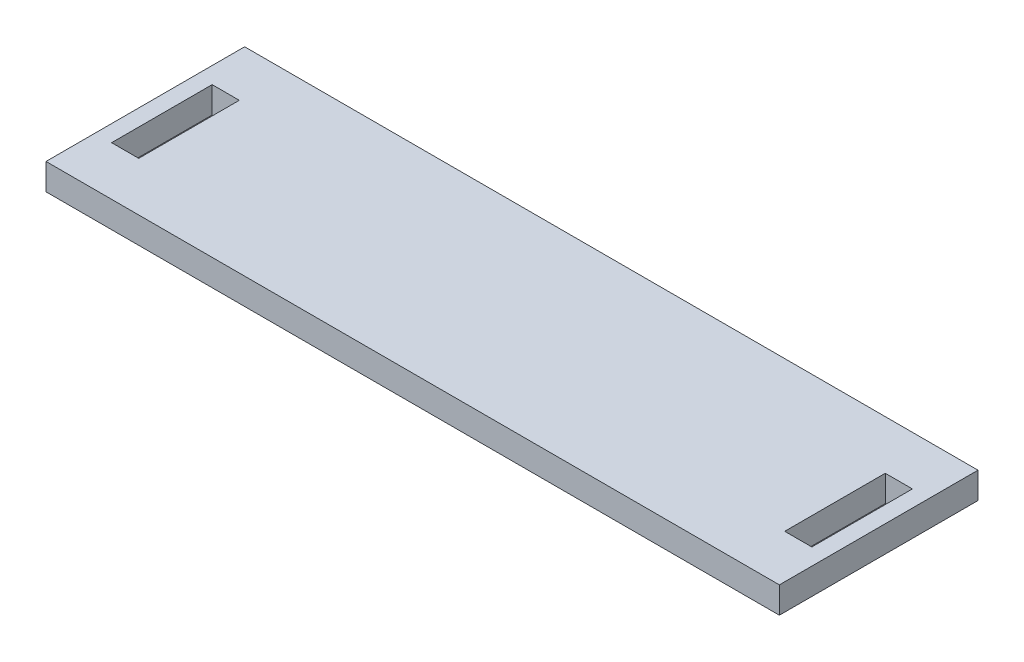
from build123d import *

# Parameters (mm, degrees)
SKETCH1_W           = 84.61
SKETCH1_H           = 24
BOSS_EXTRUDE1_DEPTH = 3.18
SKETCH10_W          = 24
SKETCH10_H          = 3.18
BOSS_EXTRUDE2_DEPTH = 2
SKETCH9_W           = 3.28
SKETCH9_H           = 12.15
CUT_EXTRUDE1_DEPTH  = 61.496753834


with BuildPart() as part:
    # Sketch1 → Boss-Extrude1 (new body)
    with BuildSketch(Plane(origin=(0, 0, 0), x_dir=(1, 0, 0), z_dir=(0, 1, 0))):
        with Locations((-13.483376754, -5.613867735)):
            Rectangle(SKETCH1_W, SKETCH1_H)
    extrude(amount=BOSS_EXTRUDE1_DEPTH)

    # Sketch10 → Boss-Extrude2 (add)
    with BuildSketch(Plane.ZY.offset(55.788376754)):
        with Locations((5.613867735, 1.59)):
            Rectangle(SKETCH10_W, SKETCH10_H)
    boss_extrude2 = extrude(amount=BOSS_EXTRUDE2_DEPTH)

    # Sketch9 → Cut-Extrude1 (cut, through all)
    with BuildSketch(Plane(origin=(0, 3.18, 0), x_dir=(1, 0, 0), z_dir=(0, 1, 0))):
        with Locations((-54.148376754, -5.613867735)):
            Rectangle(SKETCH9_W, SKETCH9_H)
    cut_extrude1 = extrude(amount=-CUT_EXTRUDE1_DEPTH, mode=Mode.SUBTRACT)

    # Mirror1: Boss-Extrude2, Cut-Extrude1 across plane
    add(boss_extrude2.mirror(Plane.ZY.offset(13.483376754)))
    add(cut_extrude1.mirror(Plane.ZY.offset(13.483376754)), mode=Mode.SUBTRACT)


solid = part.part
